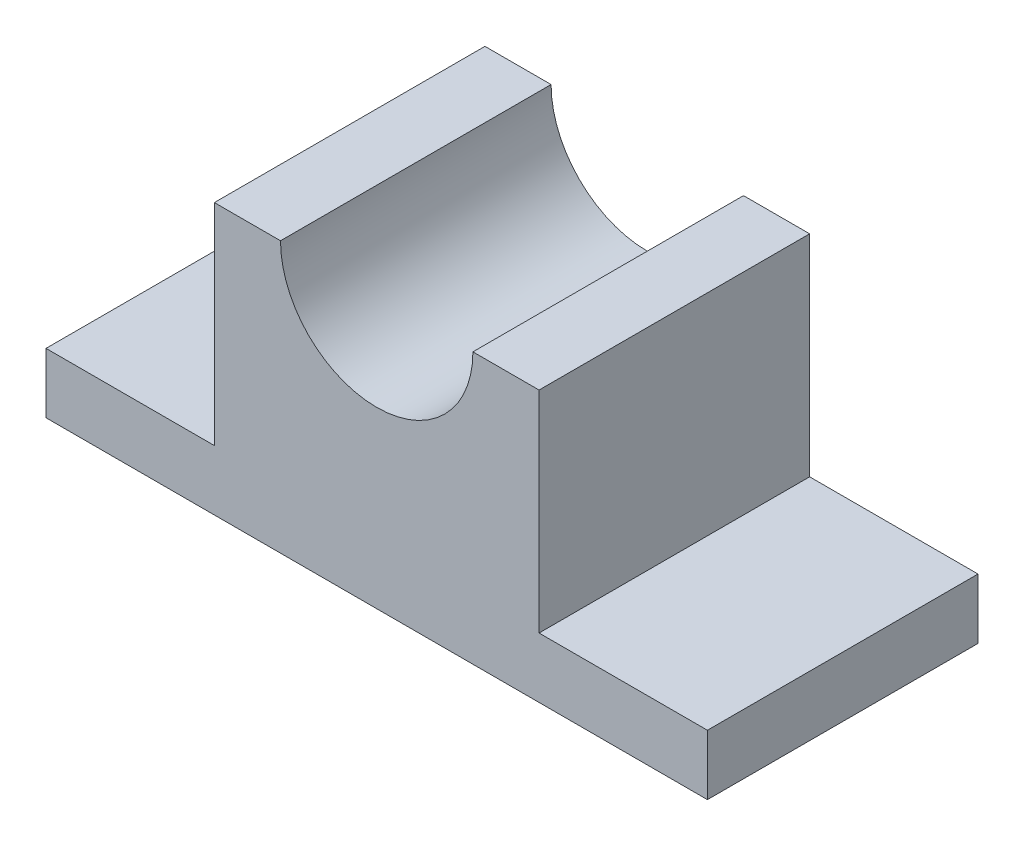
from build123d import *

# Parameters (mm, degrees)
EXTRUDE_1_DEPTH     = 45
SKETCH_2_R          = 16
CUT_EXTRUDE_1_DEPTH = 85.113019206


with BuildPart() as part:
    # 스케치1 → 보스-돌출1 (new body)
    with BuildSketch(Plane.XY):
        Polygon((-55, 0), (55, 0), (55, 10), (27, 10), (27, 45), (-27, 45), (-27, 10), (-55, 10), align=None)
    extrude(amount=EXTRUDE_1_DEPTH)

    # 스케치2 → 컷-돌출1 (cut, through all)
    with BuildSketch(Plane(origin=(0, 0, 0), x_dir=(-1, 0, 0), z_dir=(0, 0, -1))):
        with Locations((0, 45)):
            Circle(SKETCH_2_R)
    extrude(amount=-CUT_EXTRUDE_1_DEPTH, mode=Mode.SUBTRACT)


solid = part.part
